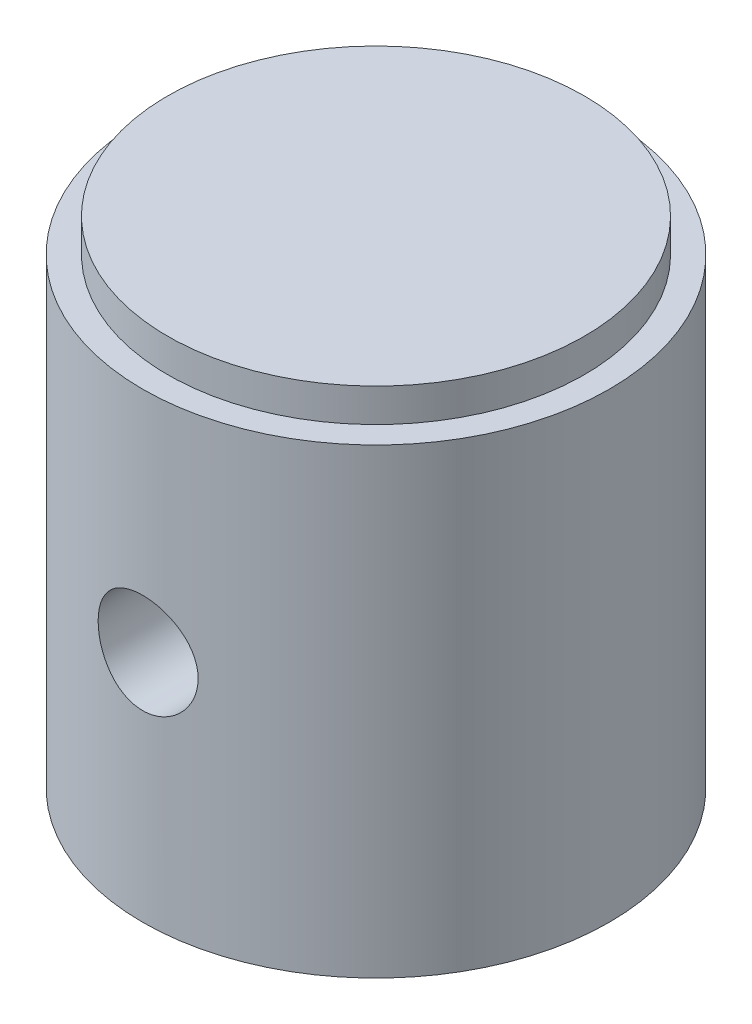
from build123d import *

# Parameters (mm, degrees)
CUT_EXTRUDE1_DEPTH      = 18.850600229
CUT_EXTRUDE1_DEPTH_BACK = 18.850600229
SKETCH2_R               = 1.5


with BuildPart() as part:
    # Sketch1 → Revolve1 (revolve)
    with BuildSketch(Plane(origin=(0, 0, 0), x_dir=(0, 0, -1), z_dir=(1, 0, 0)), mode=Mode.PRIVATE) as revolve1_sk:
        Polygon((0, 14.85408794), (-6.25, 14.85408794), (-6.25, 13.85408794), (-7, 13.85408794), (-7, 0), (-6.2, 0), (-4.75, 3.983842258), (-4.75, 11), (0, 13.85408794), align=None)
    revolve(revolve1_sk.sketch.rotate(Axis((0, 0, 0), (0, 1, 0)), 180), axis=Axis((0, 0, 0), (0, 1, 0)))

    # Sketch2 → Cut-Extrude1 (cut, two sides: drawn at the far end of the back side and taken through both)
    with BuildSketch(Plane.XY.offset(-CUT_EXTRUDE1_DEPTH_BACK)):
        with Locations((0, 7)):
            Circle(SKETCH2_R)
    extrude(amount=CUT_EXTRUDE1_DEPTH + CUT_EXTRUDE1_DEPTH_BACK, mode=Mode.SUBTRACT)


solid = part.part
